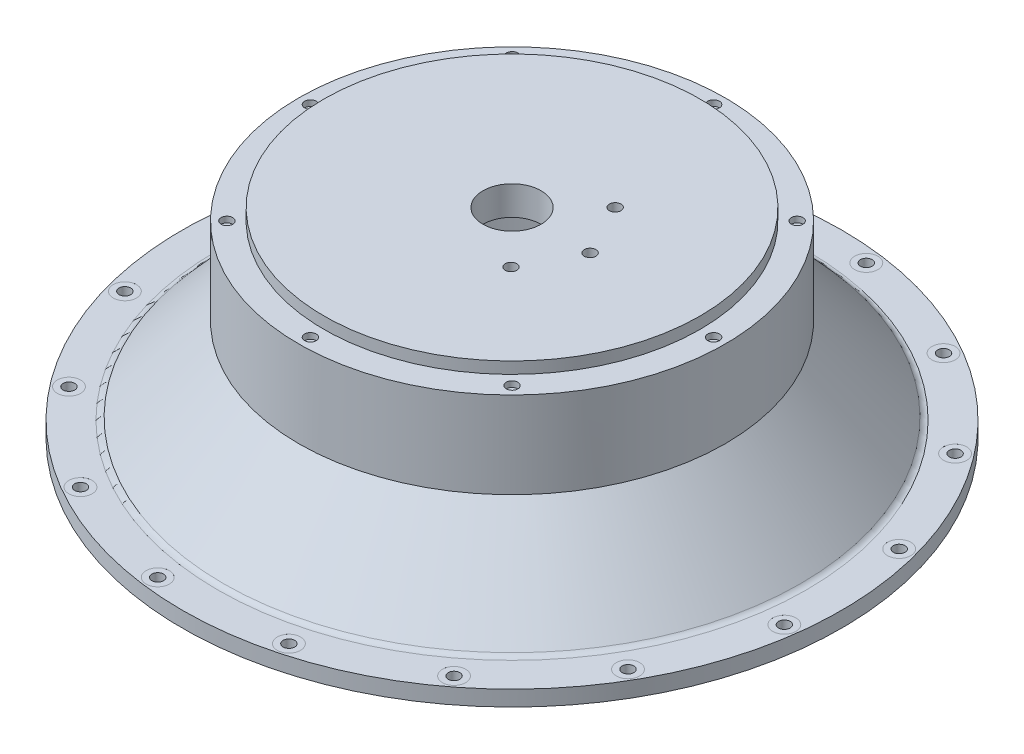
from build123d import *
from build123d.topology import SkipClean

# Parameters (mm, degrees)
SKETCH_1_R               = 85
EXTRUDE_1_DEPTH          = 4
SKETCH_2_R               = 56.4
CUT_EXTRUDE_1_DEPTH      = 50
EXTRUDE_2_REACH          = 125.657
SKETCH_8_R               = 68.956948121
SKETCH_8_R_2             = 56.4
SKETCH_9_R               = 1.5
CUT_EXTRUDE_3_DEPTH      = 5000
PATTERN_CIRCULAR_1_COUNT = 16
SKETCH_11_R              = 52.5
SKETCH_11_R_2            = 48.463912786
EXTRUDE_3_DEPTH          = 30
SKETCH_12_R              = 52.5
SKETCH_12_R_2            = 22.5
EXTRUDE_4_DEPTH          = 5
FILLET_1_R               = 2
SKETCH_13_R              = 85
SKETCH_13_R_2            = 56.4
EXTRUDE_5_DEPTH          = 1
SKETCH_14_R              = 1.5
CUT_EXTRUDE_4_DEPTH      = 50
PATTERN_CIRCULAR_2_COUNT = 16
CHAMFER_2_SIZE           = 5
SKETCH_15_R              = 45
SKETCH_15_R_2            = 43
CUT_EXTRUDE_5_DEPTH      = 2
EXTRUDE_START            = -5
SKETCH_16_R              = 22.5
SKETCH_16_R_2            = 15
EXTRUDE_6_DEPTH          = 5
SKETCH_18_R              = 3
CUT_EXTRUDE_7_DEPTH      = 0.002
PATTERN_CIRCULAR_3_COUNT = 16
EXTRUDE_7_REACH          = 138.657
SKETCH_19_R              = 55
SKETCH_19_R_2            = 49.128121992
SKETCH_20_R              = 47.909164775
SKETCH_20_R_2            = 36.467922282
EXTRUDE_9_DEPTH          = 2
SKETCH_21_R              = 61.010488539
CUT_EXTRUDE_8_DEPTH      = 15
SKETCH_22_R              = 55
EXTRUDE_11_DEPTH         = 5
SKETCH_23_R              = 1.5
CUT_EXTRUDE_9_DEPTH      = 2
PATTERN_CIRCULAR_4_COUNT = 8
SKETCH_24_R              = 48.5
EXTRUDE_12_DEPTH         = 3
SKETCH_25_R              = 7.5
CUT_EXTRUDE_10_DEPTH     = 500
SKETCH_26_R              = 99.377055334
CUT_EXTRUDE_11_DEPTH     = 1
SKETCH_27_R              = 55
SKETCH_27_R_2            = 48.5
CUT_EXTRUDE_13_DEPTH     = 0.5
SKETCH_28_R              = 50.330006294
CUT_EXTRUDE_14_DEPTH     = 0.5
SKETCH_17_R              = 1.5
CUT_EXTRUDE_17_DEPTH     = 20


with BuildPart() as part:
    # 草图1 → 凸台-拉伸1 (new body)
    with BuildSketch(Plane(origin=(0, 0, 0), x_dir=(1, 0, 0), z_dir=(0, 1, 0))):
        with Locations(Location((0, 0, 0), (0, 0, 270))):
            Circle(SKETCH_1_R)
    extrude(amount=EXTRUDE_1_DEPTH)

    # 草图2 → 切除-拉伸1 (cut)
    with BuildSketch(Plane(origin=(0, 4, 0), x_dir=(1, 0, 0), z_dir=(0, 1, 0))):
        with Locations(Location((0, 0, 0), (0, 0, 270))):
            Circle(SKETCH_2_R)
    extrude(amount=-CUT_EXTRUDE_1_DEPTH, mode=Mode.SUBTRACT)

    # 草图3 → 旋转1 (revolve)
    with BuildSketch(Plane.XY):
        Polygon((0, 4), (-75, 4), (-52.5, 29), (0, 29), align=None)
    revolve(axis=Axis((0, 29, 0), (0, -1, 0)))

    # 草图7 → 切除-旋转1 (revolve, cut)
    with BuildSketch(Plane.XY, mode=Mode.PRIVATE) as cut_revolve_1_sk:
        Polygon((0, 4), (-70.963912786, 4), (-48.463912786, 29), (0, 29), align=None)
    revolve(cut_revolve_1_sk.sketch.rotate(Axis((0, 29, 0), (0, -1, 0)), 270), axis=Axis((0, 29, 0), (0, -1, 0)), mode=Mode.SUBTRACT)

    # 凸台-拉伸2: up to this cone (the profile starts inside it)
    extrude_2_end = Plane(origin=(0, 0, 0), z_dir=(0, -1, 0)).offset(-82.848790984) * Cone(1e-06, 255.212734293, 283.56970377, align=(Align.CENTER, Align.CENTER, Align.MIN), mode=Mode.PRIVATE)
    # 草图8 → 凸台-拉伸2 (add, up to the surface)
    with BuildSketch(Plane.XZ, mode=Mode.PRIVATE) as extrude_2_sk1:
        with Locations(Location((0, 0, 0), (0, 0, 270))):
            Circle(SKETCH_8_R)
        with Locations(Location((0, 0, 0), (0, 0, 90))):
            Circle(SKETCH_8_R_2, mode=Mode.SUBTRACT)
    extrude_2_tool1 = extrude(extrude_2_sk1.sketch, amount=-EXTRUDE_2_REACH, mode=Mode.PRIVATE) & extrude_2_end
    add(extrude_2_tool1.solids().sort_by_distance((0, 0, 67.006551))[0])

    # 草图9 → 切除-拉伸3 (cut)
    with BuildSketch(Plane(origin=(0, 4, 0), x_dir=(1, 0, 0), z_dir=(0, 1, 0))):
        with Locations(Location((-40.694024124, -70.613358514, 0), (0, 0, 270))):
            Circle(SKETCH_9_R)
    cut_extrude_3 = extrude(amount=-CUT_EXTRUDE_3_DEPTH, mode=Mode.SUBTRACT)

    # 阵列(圆周)1: 切除-拉伸3 ×16 about axis
    pattern_circular_1_axis = Axis((0, 0, 0), (0, 1, 0))
    for i in range(1, PATTERN_CIRCULAR_1_COUNT):
        add(cut_extrude_3.rotate(pattern_circular_1_axis, i * 360 / PATTERN_CIRCULAR_1_COUNT), mode=Mode.SUBTRACT)

    # 草图11 → 凸台-拉伸3 (add)
    with BuildSketch(Plane(origin=(0, 29, 0), x_dir=(1, 0, 0), z_dir=(0, 1, 0))):
        with Locations(Location((0, 0, 0), (0, 0, 180))):
            Circle(SKETCH_11_R)
        with Locations(Location((0, 0, 0), (0, 0, 180))):
            Circle(SKETCH_11_R_2, mode=Mode.SUBTRACT)
    extrude(amount=EXTRUDE_3_DEPTH)

    # 草图12 → 凸台-拉伸4 (add)
    with BuildSketch(Plane(origin=(0, 59, 0), x_dir=(1, 0, 0), z_dir=(0, 1, 0))):
        with Locations(Location((0, 0, 0), (0, 0, 180))):
            Circle(SKETCH_12_R)
        with Locations(Location((0, 0, 0), (0, 0, 180))):
            Circle(SKETCH_12_R_2, mode=Mode.SUBTRACT)
    extrude(amount=EXTRUDE_4_DEPTH)

    # 圆角1
    fillet_1_edges = [part.edges().sort_by_distance(p)[0] for p in [
        (75, 4, 0),
    ]]
    fillet(fillet_1_edges, radius=FILLET_1_R)

    # 草图13 → 凸台-拉伸5 (add)
    with SkipClean():  # the faces are left unmerged after this step: merging them gives an invalid solid
        with BuildSketch(Plane.XZ):
            with Locations(Location((0, 0, 0), (0, 0, 270))):
                Circle(SKETCH_13_R)
            with Locations(Location((0, 0, 0), (0, 0, 270))):
                Circle(SKETCH_13_R_2, mode=Mode.SUBTRACT)
        extrude(amount=EXTRUDE_5_DEPTH)

    # 草图14 → 切除-拉伸4 (cut)
    with SkipClean():  # the faces are left unmerged after this step: merging them gives an invalid solid
        with BuildSketch(Plane(origin=(0, 4, 0), x_dir=(1, 0, 0), z_dir=(0, 1, 0))):
            with Locations(Location((-70.613358514, 40.694024124, 0), (0, 0, 180))):
                Circle(SKETCH_14_R)
        cut_extrude_4 = extrude(amount=-CUT_EXTRUDE_4_DEPTH, mode=Mode.SUBTRACT)

    # 阵列(圆周)2: 切除-拉伸4 ×16 about axis
    with SkipClean():  # the faces are left unmerged after this step: merging them gives an invalid solid
        pattern_circular_2_axis = Axis((0, 0, 0), (0, 1, 0))
        for i in range(1, PATTERN_CIRCULAR_2_COUNT):
            add(cut_extrude_4.rotate(pattern_circular_2_axis, i * 360 / PATTERN_CIRCULAR_2_COUNT), mode=Mode.SUBTRACT)

    # 倒角2
    chamfer_2_edges = [part.edges().sort_by_distance(p)[0] for p in [
        (48.463912786, 59, 0),
    ]]
    chamfer(chamfer_2_edges, length=CHAMFER_2_SIZE)

    # 草图15 → 切除-拉伸5 (cut)
    with SkipClean():  # the faces are left unmerged after this step: merging them gives an invalid solid
        with BuildSketch(Plane(origin=(0, 64, 0), x_dir=(1, 0, 0), z_dir=(0, 1, 0))):
            with Locations(Location((0, 0, 0), (0, 0, 180))):
                Circle(SKETCH_15_R)
            with Locations(Location((0, 0, 0), (0, 0, 180))):
                Circle(SKETCH_15_R_2, mode=Mode.SUBTRACT)
        extrude(amount=-CUT_EXTRUDE_5_DEPTH, mode=Mode.SUBTRACT)

    # 草图16 → 凸台-拉伸6 (add)
    with SkipClean():  # the faces are left unmerged after this step: merging them gives an invalid solid
        with BuildSketch(Plane(origin=(0, 64, 0), x_dir=(1, 0, 0), z_dir=(0, 1, 0)).offset(EXTRUDE_START)):
            Circle(SKETCH_16_R)
            with Locations(Location((0, 0, 0), (0, 0, 180))):
                Circle(SKETCH_16_R_2, mode=Mode.SUBTRACT)
        extrude(amount=EXTRUDE_6_DEPTH)

    # 草图18 → 切除-拉伸7 (cut)
    with SkipClean():  # the faces are left unmerged after this step: merging them gives an invalid solid
        with BuildSketch(Plane(origin=(0, 4, 0), x_dir=(1, 0, 0), z_dir=(0, 1, 0))):
            with Locations(Location((-80.811165481, 10.573813577, 0), (0, 0, 270))):
                Circle(SKETCH_18_R)
        cut_extrude_7 = extrude(amount=-CUT_EXTRUDE_7_DEPTH, mode=Mode.SUBTRACT)

    # 阵列(圆周)3: 切除-拉伸7 ×16 about axis
    with SkipClean():  # the faces are left unmerged after this step: merging them gives an invalid solid
        pattern_circular_3_axis = Axis((0, 0, 0), (0, 1, 0))
        for i in range(1, PATTERN_CIRCULAR_3_COUNT):
            add(cut_extrude_7.rotate(pattern_circular_3_axis, i * 360 / PATTERN_CIRCULAR_3_COUNT), mode=Mode.SUBTRACT)

    # 凸台-拉伸7: up to this cone (the profile starts outside it)
    with SkipClean():  # the faces are left unmerged after this step: merging them gives an invalid solid
        extrude_7_end = Plane(origin=(0, 64, 0), z_dir=(0, -1, 0)).offset(-23.333332333) * Cone(1e-06, 165.1413, 183.490332333, align=(Align.CENTER, Align.CENTER, Align.MIN), mode=Mode.PRIVATE)
        # 草图19 → 凸台-拉伸7 (add, up to the surface)
        with BuildSketch(Plane(origin=(0, 64, 0), x_dir=(1, 0, 0), z_dir=(0, 1, 0)), mode=Mode.PRIVATE) as extrude_7_sk1:
            with Locations(Location((0, 0, 0), (0, 0, 180))):
                Circle(SKETCH_19_R)
            Circle(SKETCH_19_R_2, mode=Mode.SUBTRACT)
        extrude_7_tool1 = extrude(extrude_7_sk1.sketch, amount=-EXTRUDE_7_REACH, mode=Mode.PRIVATE) - extrude_7_end
        add(extrude_7_tool1.solids().sort_by_distance((53.444365, 64, 0))[0])

    # 草图20 → 凸台-拉伸9 (add)
    with SkipClean():  # the faces are left unmerged after this step: merging them gives an invalid solid
        with BuildSketch(Plane(origin=(0, 64, 0), x_dir=(1, 0, 0), z_dir=(0, 1, 0))):
            Circle(SKETCH_20_R)
            Circle(SKETCH_20_R_2, mode=Mode.SUBTRACT)
        extrude(amount=-EXTRUDE_9_DEPTH)

    # 草图21 → 切除-拉伸8 (cut)
    with SkipClean():  # the faces are left unmerged after this step: merging them gives an invalid solid
        with BuildSketch(Plane(origin=(0, 64, 0), x_dir=(1, 0, 0), z_dir=(0, 1, 0))):
            Circle(SKETCH_21_R)
        extrude(amount=-CUT_EXTRUDE_8_DEPTH, mode=Mode.SUBTRACT)

    # 草图22 → 凸台-拉伸11 (add)
    with SkipClean():  # the faces are left unmerged after this step: merging them gives an invalid solid
        with BuildSketch(Plane(origin=(0, 49, 0), x_dir=(1, 0, 0), z_dir=(0, 1, 0))):
            with Locations(Location((0, 0, 0), (0, 0, 180))):
                Circle(SKETCH_22_R)
        extrude(amount=-EXTRUDE_11_DEPTH)

    # 草图23 → 切除-拉伸9 (cut)
    with SkipClean():  # the faces are left unmerged after this step: merging them gives an invalid solid
        with BuildSketch(Plane(origin=(0, 49, 0), x_dir=(1, 0, 0), z_dir=(0, 1, 0))):
            with Locations(Location((52, 0, 0), (0, 0, 180))):
                Circle(SKETCH_23_R)
        cut_extrude_9 = extrude(amount=-CUT_EXTRUDE_9_DEPTH, mode=Mode.SUBTRACT)

    # 阵列(圆周)4: 切除-拉伸9 ×8 about axis
    with SkipClean():  # the faces are left unmerged after this step: merging them gives an invalid solid
        pattern_circular_4_axis = Axis((0, 0, 0), (0, 1, 0))
        for i in range(1, PATTERN_CIRCULAR_4_COUNT):
            add(cut_extrude_9.rotate(pattern_circular_4_axis, i * 360 / PATTERN_CIRCULAR_4_COUNT), mode=Mode.SUBTRACT)

    # 草图24 → 凸台-拉伸12 (add)
    with SkipClean():  # the faces are left unmerged after this step: merging them gives an invalid solid
        with BuildSketch(Plane(origin=(0, 49, 0), x_dir=(1, 0, 0), z_dir=(0, 1, 0))):
            with Locations(Location((0, 0, 0), (0, 0, 180))):
                Circle(SKETCH_24_R)
        extrude(amount=EXTRUDE_12_DEPTH)

    # 草图25 → 切除-拉伸10 (cut)
    with SkipClean():  # the faces are left unmerged after this step: merging them gives an invalid solid
        with BuildSketch(Plane(origin=(0, 52, 0), x_dir=(1, 0, 0), z_dir=(0, 1, 0))):
            with Locations(Location((0, 0, 0), (0, 0, 180))):
                Circle(SKETCH_25_R)
        extrude(amount=-CUT_EXTRUDE_10_DEPTH, mode=Mode.SUBTRACT)

    # 草图26 → 切除-拉伸11 (cut)
    with BuildSketch(Plane.XZ.offset(1)):
        Circle(SKETCH_26_R)
    extrude(amount=-CUT_EXTRUDE_11_DEPTH, mode=Mode.SUBTRACT)

    # 草图27 → 切除-拉伸13 (cut)
    with BuildSketch(Plane(origin=(0, 49, 0), x_dir=(1, 0, 0), z_dir=(0, 1, 0))):
        with Locations(Location((0, 0, 0), (0, 0, 180))):
            Circle(SKETCH_27_R)
        with Locations(Location((0, 0, 0), (0, 0, 180))):
            Circle(SKETCH_27_R_2, mode=Mode.SUBTRACT)
    extrude(amount=-CUT_EXTRUDE_13_DEPTH, mode=Mode.SUBTRACT)

    # 草图28 → 切除-拉伸14 (cut)
    with BuildSketch(Plane(origin=(0, 52, 0), x_dir=(1, 0, 0), z_dir=(0, 1, 0))):
        Circle(SKETCH_28_R)
    extrude(amount=-CUT_EXTRUDE_14_DEPTH, mode=Mode.SUBTRACT)

    # 草图17 → 切除-拉伸17 (cut)
    with BuildSketch(Plane(origin=(0, 64, 0), x_dir=(1, 0, 0), z_dir=(0, 1, 0))):
        with Locations(Location((13.161077513, -13.427494448, 0), (0, 0, 180))):
            Circle(SKETCH_17_R)
        with Locations(Location((20.214261652, -0.080464123, 0), (0, 0, 180))):
            Circle(SKETCH_17_R)
        with Locations(Location((13.267556705, 13.322293629, 0), (0, 0, 180))):
            Circle(SKETCH_17_R)
    extrude(amount=-CUT_EXTRUDE_17_DEPTH, mode=Mode.SUBTRACT)


solid = part.part
